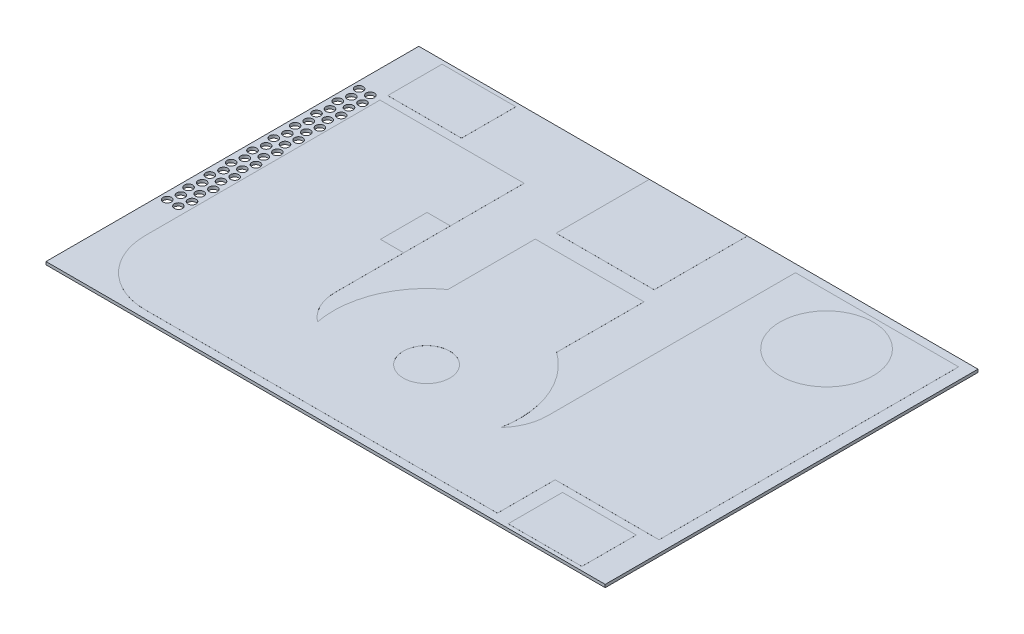
from build123d import *

# Parameters (mm, degrees)
SKETCH1_W          = 3657.6
SKETCH1_H          = 2438.4
GRASS_DEPTH        = 19.05
DIMENSIONS_R       = 152.4
DIMENSIONS_R_2     = 304.8
STREET_DEPTH       = 0.254
SKETCH2_4_W        = 482.6
SKETCH2_4_H        = 355.6
BASES_DEPTH        = 0.254
BASES_2_DEPTH      = 0.254
DIMENSIONS_5_R     = 304.8
MT_SIMMONS_DEPTH   = 0.254
DIMENSIONS_6_W     = 641.35
DIMENSIONS_6_H     = 609.6
HOUSE_DEPTH        = 0.254
SKETCH4_R          = 26.9875
CUT_EXTRUDE3_DEPTH = 19.05
CUT_EXTRUDE3_TAPER = 1
DIMENSIONS_8_W     = 152.4
DIMENSIONS_8_H     = 304.8
PARKING_DEPTH      = 0.254


with BuildPart() as part:
    # Sketch1 → Grass (new body)
    with BuildSketch(Plane(origin=(0, 0, 0), x_dir=(1, 0, 0), z_dir=(0, 1, 0))):
        with Locations((1828.8, 1219.2)):
            Rectangle(SKETCH1_W, SKETCH1_H)
    extrude(amount=-GRASS_DEPTH)

    # Sketch4 → Cut-Extrude3 (cut)
    with BuildSketch(Plane(origin=(0, 0, 0), x_dir=(1, 0, 0), z_dir=(0, 1, 0))):
        with Locations((46.0375, 2001.8375)):
            Circle(SKETCH4_R)
        with Locations((65.0875, 1932.14625)):
            Circle(SKETCH4_R)
        with Locations((46.0375, 1862.3915)):
            Circle(SKETCH4_R)
        with Locations((46.0375, 1722.9455)):
            Circle(SKETCH4_R)
        with Locations((46.0375, 1583.4995)):
            Circle(SKETCH4_R)
        with Locations((46.0375, 1444.0535)):
            Circle(SKETCH4_R)
        with Locations((46.0375, 1304.6075)):
            Circle(SKETCH4_R)
        with Locations((46.0375, 1165.1615)):
            Circle(SKETCH4_R)
        with Locations((46.0375, 1025.7155)):
            Circle(SKETCH4_R)
        with Locations((46.0375, 886.2695)):
            Circle(SKETCH4_R)
        with Locations((46.0375, 746.8235)):
            Circle(SKETCH4_R)
        with Locations((65.0875, 1792.76375)):
            Circle(SKETCH4_R)
        with Locations((65.0875, 1653.38125)):
            Circle(SKETCH4_R)
        with Locations((65.0875, 1513.99875)):
            Circle(SKETCH4_R)
        with Locations((65.0875, 1374.61625)):
            Circle(SKETCH4_R)
        with Locations((65.0875, 1235.23375)):
            Circle(SKETCH4_R)
        with Locations((65.0875, 1095.85125)):
            Circle(SKETCH4_R)
        with Locations((65.0875, 956.46875)):
            Circle(SKETCH4_R)
        with Locations((65.0875, 817.08625)):
            Circle(SKETCH4_R)
        with Locations((138.1125, 1792.76375)):
            Circle(SKETCH4_R)
        with Locations((138.1125, 1653.38125)):
            Circle(SKETCH4_R)
        with Locations((138.1125, 1513.99875)):
            Circle(SKETCH4_R)
        with Locations((138.1125, 1374.61625)):
            Circle(SKETCH4_R)
        with Locations((138.1125, 1235.23375)):
            Circle(SKETCH4_R)
        with Locations((138.1125, 1095.85125)):
            Circle(SKETCH4_R)
        with Locations((138.1125, 956.46875)):
            Circle(SKETCH4_R)
        with Locations((138.1125, 817.08625)):
            Circle(SKETCH4_R)
        with Locations((138.1125, 1932.14625)):
            Circle(SKETCH4_R)
        with Locations((119.1895, 2001.8375)):
            Circle(SKETCH4_R)
        with Locations((119.1895, 1862.3915)):
            Circle(SKETCH4_R)
        with Locations((119.1895, 1722.9455)):
            Circle(SKETCH4_R)
        with Locations((119.1895, 1583.4995)):
            Circle(SKETCH4_R)
        with Locations((119.1895, 1444.0535)):
            Circle(SKETCH4_R)
        with Locations((119.1895, 1304.6075)):
            Circle(SKETCH4_R)
        with Locations((119.1895, 1165.1615)):
            Circle(SKETCH4_R)
        with Locations((119.1895, 1025.7155)):
            Circle(SKETCH4_R)
        with Locations((119.1895, 886.2695)):
            Circle(SKETCH4_R)
        with Locations((119.1895, 746.8235)):
            Circle(SKETCH4_R)
    extrude(amount=-CUT_EXTRUDE3_DEPTH, taper=CUT_EXTRUDE3_TAPER, mode=Mode.SUBTRACT)


with BuildPart() as body_2:
    # Dimensions → Street (new body)
    with BuildSketch(Plane(origin=(0, 0, 0), x_dir=(1, 0, 0), z_dir=(0, 1, 0))):
        with BuildLine():
            Line((1120.775, 2006.6), (177.8, 2006.6))
            Line((177.8, 2006.6), (177.8, 469.9))
            ThreePointArc((177.8, 469.9), (300.551548005, 173.551548005), (596.9, 50.8))
            Line((596.9, 50.8), (2901.95, 50.8))
            Line((2901.95, 50.8), (2901.95, 428.625))
            Line((2901.95, 428.625), (3581.4, 428.625))
            Line((3581.4, 428.625), (3581.4, 2387.6))
            Line((3581.4, 2387.6), (2514.6, 2387.6))
            Line((2514.6, 2387.6), (2514.6, 768.35))
            ThreePointArc((2514.6, 768.35), (2492.071935398, 649.012177724), (2427.588501894, 546.1))
            ThreePointArc((2427.588501894, 546.1), (2394.987039691, 886.330069016), (2184.4, 1155.537152716))
            Line((2184.4, 1155.537152716), (2184.4, 1727.2))
            Line((2184.4, 1727.2), (1473.2, 1727.2))
            Line((1473.2, 1727.2), (1473.2, 1155.537152716))
            ThreePointArc((1473.2, 1155.537152716), (1262.612960309, 886.330069016), (1230.011498106, 546.1))
            ThreePointArc((1230.011498106, 546.1), (1149.559977358, 644.527874535), (1120.775, 768.35))
            Line((1120.775, 768.35), (1120.775, 1219.2))
            Line((1120.775, 1219.2), (968.375, 1219.2))
            Line((968.375, 1219.2), (968.375, 1524))
            Line((968.375, 1524), (1120.775, 1524))
            Line((1120.775, 1524), (1120.775, 2006.6))
        make_face()
        with Locations(Location((1828.8, 660.4, 0), (0, 0, 270))):
            Circle(DIMENSIONS_R, mode=Mode.SUBTRACT)
        with Locations(Location((3048, 2057.4, 0), (0, 0, 270))):
            Circle(DIMENSIONS_R_2, mode=Mode.SUBTRACT)
    extrude(amount=STREET_DEPTH)


with BuildPart() as body_3:
    # Sketch2<4> → Bases (new body)
    with BuildSketch(Plane(origin=(0, 0, 0), x_dir=(1, 0, 0), z_dir=(0, 1, 0))):
        with Locations((419.1, 2235.2)):
            Rectangle(SKETCH2_4_W, SKETCH2_4_H)
    extrude(amount=BASES_DEPTH)


with BuildPart() as body_4:
    # Sketch2<4> → Bases 2 (new body)
    with BuildSketch(Plane(origin=(0, 0, 0), x_dir=(1, 0, 0), z_dir=(0, 1, 0))):
        with Locations((3238.5, 203.2)):
            Rectangle(SKETCH2_4_W, SKETCH2_4_H)
    extrude(amount=BASES_2_DEPTH)


with BuildPart() as body_5:
    # Dimensions<5> → Mt Simmons (new body)
    with BuildSketch(Plane(origin=(0, 0, 0), x_dir=(1, 0, 0), z_dir=(0, 1, 0))):
        with Locations(Location((3048, 2057.4, 0), (0, 0, 270))):
            Circle(DIMENSIONS_5_R)
    extrude(amount=MT_SIMMONS_DEPTH)


with BuildPart() as body_6:
    # Dimensions<6> → House (new body)
    with BuildSketch(Plane(origin=(0, 0, 0), x_dir=(1, 0, 0), z_dir=(0, 1, 0))):
        with Locations((1828.8, 2133.6)):
            Rectangle(DIMENSIONS_6_W, DIMENSIONS_6_H)
    extrude(amount=HOUSE_DEPTH)


with BuildPart() as body_7:
    # Dimensions<8> → Parking (new body)
    with BuildSketch(Plane(origin=(0, 0, 0), x_dir=(1, 0, 0), z_dir=(0, 1, 0))):
        with Locations((1044.575, 1371.6)):
            Rectangle(DIMENSIONS_8_W, DIMENSIONS_8_H)
    extrude(amount=PARKING_DEPTH)


solid = Compound([part.part, body_2.part, body_3.part, body_4.part, body_5.part, body_6.part, body_7.part])
